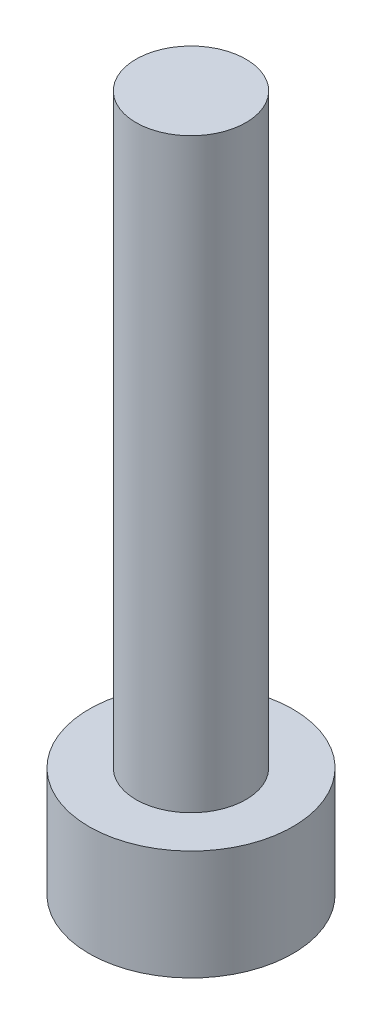
from build123d import *

# Parameters (mm, degrees)
SKETCH1_R           = 2.78
BOSS_EXTRUDE1_DEPTH = 3
SKETCH2_R           = 1.5
BOSS_EXTRUDE2_DEPTH = 16


with BuildPart() as part:
    # Sketch1 → Boss-Extrude1 (new body)
    with BuildSketch(Plane(origin=(0, 0, 0), x_dir=(1, 0, 0), z_dir=(0, 1, 0))):
        with Locations(Location((0, 0, 0), (0, 0, 270))):
            Circle(SKETCH1_R)
    extrude(amount=BOSS_EXTRUDE1_DEPTH)

    # Sketch2 → Boss-Extrude2 (add)
    with BuildSketch(Plane(origin=(0, 3, 0), x_dir=(1, 0, 0), z_dir=(0, 1, 0))):
        with Locations(Location((0, 0, 0), (0, 0, 270))):
            Circle(SKETCH2_R)
    extrude(amount=BOSS_EXTRUDE2_DEPTH)


solid = part.part
